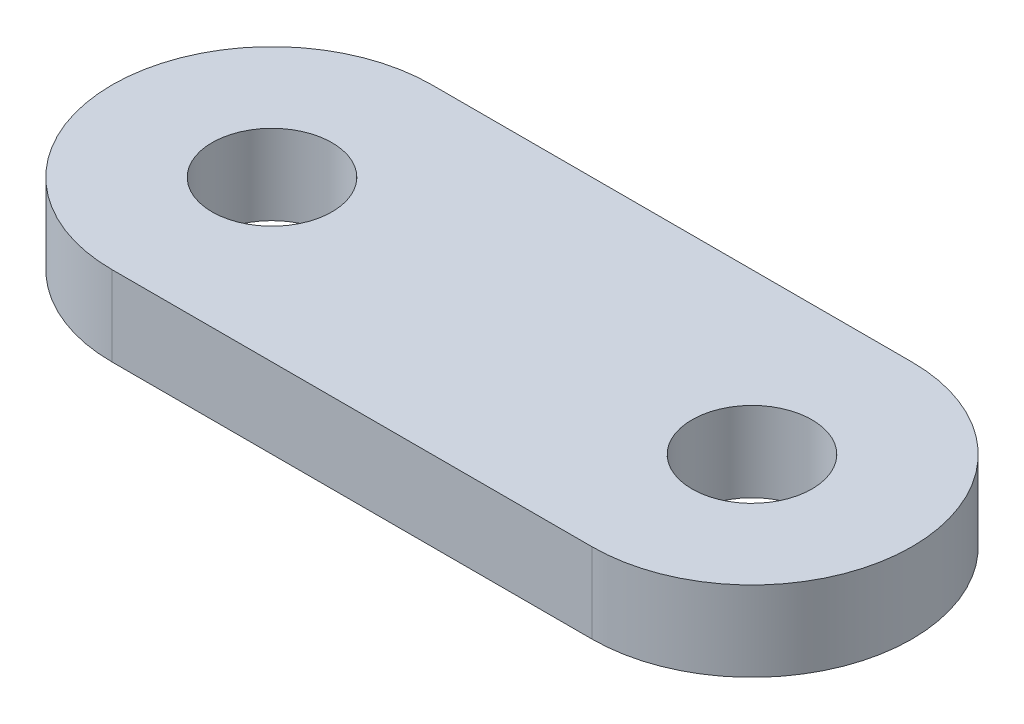
from build123d import *

# Parameters (mm, degrees)
SKETCH1_R           = 7.5
BOSS_EXTRUDE1_DEPTH = 10


with BuildPart() as part:
    # Sketch1 → Boss-Extrude1 (new body)
    with BuildSketch(Plane(origin=(0, 0, 0), x_dir=(1, 0, 0), z_dir=(0, 1, 0))):
        with BuildLine():
            Line((30, -20), (-30, -20))
            ThreePointArc((-30, -20), (-50, 0), (-30, 20))
            Line((-30, 20), (30, 20))
            ThreePointArc((30, 20), (50, 0), (30, -20))
        make_face()
        with Locations(Location((-30, 0, 0), (0, 0, 270))):
            Circle(SKETCH1_R, mode=Mode.SUBTRACT)
        with Locations(Location((30, 0, 0), (0, 0, 270))):
            Circle(SKETCH1_R, mode=Mode.SUBTRACT)
    extrude(amount=BOSS_EXTRUDE1_DEPTH)


solid = part.part
